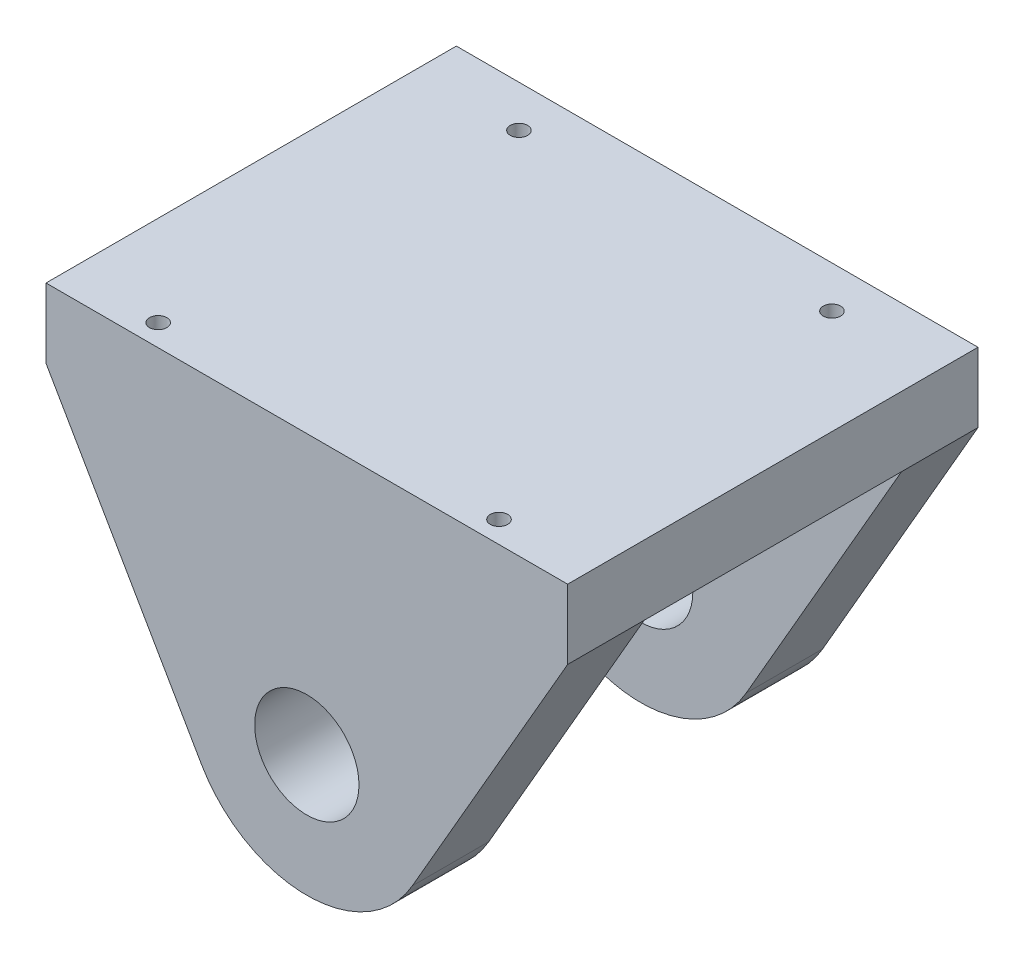
from build123d import *

# Parameters (mm, degrees)
SKETCH1_R                       = 7.5
BOSS_EXTRUDE1_DEPTH             = 11
SKETCH1_3_W                     = 75
SKETCH1_3_H                     = 10
BOSS_EXTRUDE2_DEPTH             = 59
TAP_DRILL_FOR_M3X0_5_TAP1_D     = 2.5
TAP_DRILL_FOR_M3X0_5_TAP1_DEPTH = 8
TAP_DRILL_FOR_M3X0_5_TAP1_TIP   = 0.751075774


with BuildPart() as part:
    # Sketch1 → Boss-Extrude1 (new body)
    with BuildSketch(Plane.XY):
        with BuildLine():
            Line((37.5, 30), (-37.5, 30))
            Line((-37.5, 30), (-15.160146889, -8.741850278))
            ThreePointArc((-15.160146889, -8.741850278), (0, -17.5), (15.160146889, -8.741850278))
            Line((15.160146889, -8.741850278), (37.5, 30))
        make_face()
        Circle(SKETCH1_R, mode=Mode.SUBTRACT)
    boss_extrude1 = extrude(amount=-BOSS_EXTRUDE1_DEPTH)

    # Sketch1<3> → Boss-Extrude2 (add)
    with BuildSketch(Plane.XY):
        with Locations((0, 35)):
            Rectangle(SKETCH1_3_W, SKETCH1_3_H)
    extrude(amount=-BOSS_EXTRUDE2_DEPTH)

    # Mirror2: Boss-Extrude1 across plane
    add(boss_extrude1.mirror(Plane.XY.offset(-29.5)))

    # Tap Drill for M3x0.5 Tap1
    with Locations(Plane(origin=(0, 40, 0), x_dir=(1, 0, 0), z_dir=(0, 1, 0))):
        with Locations((-22.5, 53), (22.5, 53), (-24.5, 3.13), (24.5, 3.13)):
            Hole(TAP_DRILL_FOR_M3X0_5_TAP1_D / 2, depth=TAP_DRILL_FOR_M3X0_5_TAP1_DEPTH)
            with Locations((0, 0, -(TAP_DRILL_FOR_M3X0_5_TAP1_DEPTH + TAP_DRILL_FOR_M3X0_5_TAP1_TIP / 2))):  # 118° drill point
                Cone(0, TAP_DRILL_FOR_M3X0_5_TAP1_D / 2, TAP_DRILL_FOR_M3X0_5_TAP1_TIP, mode=Mode.SUBTRACT)


solid = part.part
